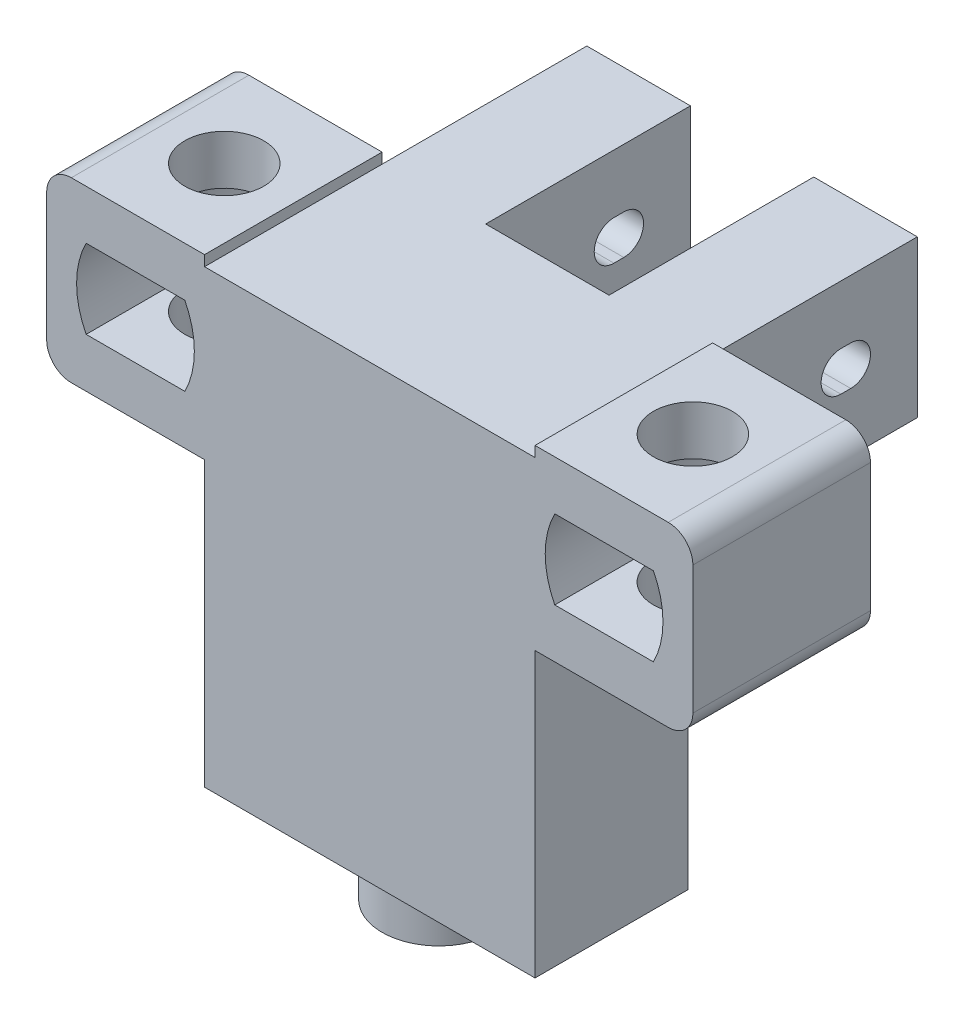
from build123d import *

# Parameters (mm, degrees)
EXTRUDE_1_DEPTH          = 3.6
EXTRUDE_START            = -0.425
SKETCH_2_W               = 4.2
SKETCH_2_H               = 9
EXTRUDE_2_DEPTH          = 6.35
CUT_EXTRUDE_1_DEPTH      = 20.106543382
CUT_EXTRUDE_1_DEPTH_BACK = 20.106543382
SKETCH_2_3_R             = 1.6
SKETCH_5_W               = 13.4
SKETCH_5_H               = 11.925
EXTRUDE_3_DEPTH          = 6.2
SKETCH_6_R               = 2.3
EXTRUDE_4_DEPTH          = 2
CUT_EXTRUDE_2_DEPTH      = 29.741259541
CUT_EXTRUDE_2_DEPTH_BACK = 29.741259541


with BuildPart() as part:
    # 草图1 → 凸台-拉伸1 (new, symmetric)
    with BuildSketch(Plane.XY):
        with BuildLine():
            Line((-12.1, -3.6), (-6.7, -3.6))
            Line((-6.7, -3.6), (-6.7, -3.175))
            Line((-6.7, -3.175), (6.7, -3.175))
            Line((6.7, -3.175), (6.7, -3.6))
            Line((6.7, -3.6), (12.1, -3.6))
            ThreePointArc((12.1, -3.6), (12.807106781, -3.307106781), (13.1, -2.6))
            Line((13.1, -2.6), (13.1, 2.6))
            ThreePointArc((13.1, 2.6), (12.807106781, 3.307106781), (12.1, 3.6))
            Line((12.1, 3.6), (6.7, 3.6))
            Line((6.7, 3.6), (6.7, 3.175))
            Line((6.7, 3.175), (-6.7, 3.175))
            Line((-6.7, 3.175), (-6.7, 3.6))
            Line((-6.7, 3.6), (-12.1, 3.6))
            ThreePointArc((-12.1, 3.6), (-12.807106781, 3.307106781), (-13.1, 2.6))
            Line((-13.1, 2.6), (-13.1, -2.6))
            ThreePointArc((-13.1, -2.6), (-12.807106781, -3.307106781), (-12.1, -3.6))
        make_face()
        with BuildLine():
            Line((11.5, -1.6), (7.5, -1.6))
            ThreePointArc((7.5, -1.6), (7.112876483, 0), (7.5, 1.6))
            Line((7.5, 1.6), (11.5, 1.6))
            ThreePointArc((11.5, 1.6), (11.887123517, 0), (11.5, -1.6))
        make_face(mode=Mode.SUBTRACT)
        with BuildLine():
            Line((-11.5, 1.6), (-7.5, 1.6))
            ThreePointArc((-7.5, 1.6), (-7.112876483, 0), (-7.5, -1.6))
            Line((-7.5, -1.6), (-11.5, -1.6))
            ThreePointArc((-11.5, -1.6), (-11.887123517, 0), (-11.5, 1.6))
        make_face(mode=Mode.SUBTRACT)
    extrude(amount=EXTRUDE_1_DEPTH, both=True)

    # 草图2 → 凸台-拉伸2 (add)
    with BuildSketch(Plane(origin=(0, 3.6, 0), x_dir=(1, 0, 0), z_dir=(0, 1, 0)).offset(EXTRUDE_START)):
        with Locations((4.6, 7.4)):
            Rectangle(SKETCH_2_W, SKETCH_2_H)
        with Locations((-4.6, 7.4)):
            Rectangle(SKETCH_2_W, SKETCH_2_H)
    extrude(amount=-EXTRUDE_2_DEPTH)

    # 草图2<3> → 切除-拉伸1 (cut, two sides: drawn at the far end of the back side and taken through both)
    with BuildSketch(Plane(origin=(0, 3.6, 0), x_dir=(1, 0, 0), z_dir=(0, 1, 0)).offset(-CUT_EXTRUDE_1_DEPTH_BACK)):
        with Locations((-9.5, 0)):
            Circle(SKETCH_2_3_R)
        with Locations((9.5, 0)):
            Circle(SKETCH_2_3_R)
    extrude(amount=CUT_EXTRUDE_1_DEPTH + CUT_EXTRUDE_1_DEPTH_BACK, mode=Mode.SUBTRACT)

    # 草图5 → 凸台-拉伸3 (add)
    with BuildSketch(Plane.XY.offset(3.6)):
        with Locations((0, -9.1375)):
            Rectangle(SKETCH_5_W, SKETCH_5_H)
    extrude(amount=-EXTRUDE_3_DEPTH)

    # 草图6 → 凸台-拉伸4 (add)
    with BuildSketch(Plane.XZ.offset(15.1)):
        with Locations((0, 0.8)):
            Circle(SKETCH_6_R)
    extrude(amount=EXTRUDE_4_DEPTH)

    # 草图7 → 切除-拉伸2 (cut, two sides: drawn at the far end of the back side and taken through both)
    with BuildSketch(Plane.ZY.offset(6.7).offset(-CUT_EXTRUDE_2_DEPTH_BACK)):
        with BuildLine():
            Line((-8.8, -0.8), (-9.2, -0.8))
            ThreePointArc((-9.2, -0.8), (-10, 0), (-9.2, 0.8))
            Line((-9.2, 0.8), (-8.8, 0.8))
            ThreePointArc((-8.8, 0.8), (-8, 0), (-8.8, -0.8))
        make_face()
    extrude(amount=CUT_EXTRUDE_2_DEPTH + CUT_EXTRUDE_2_DEPTH_BACK, mode=Mode.SUBTRACT)


solid = part.part
